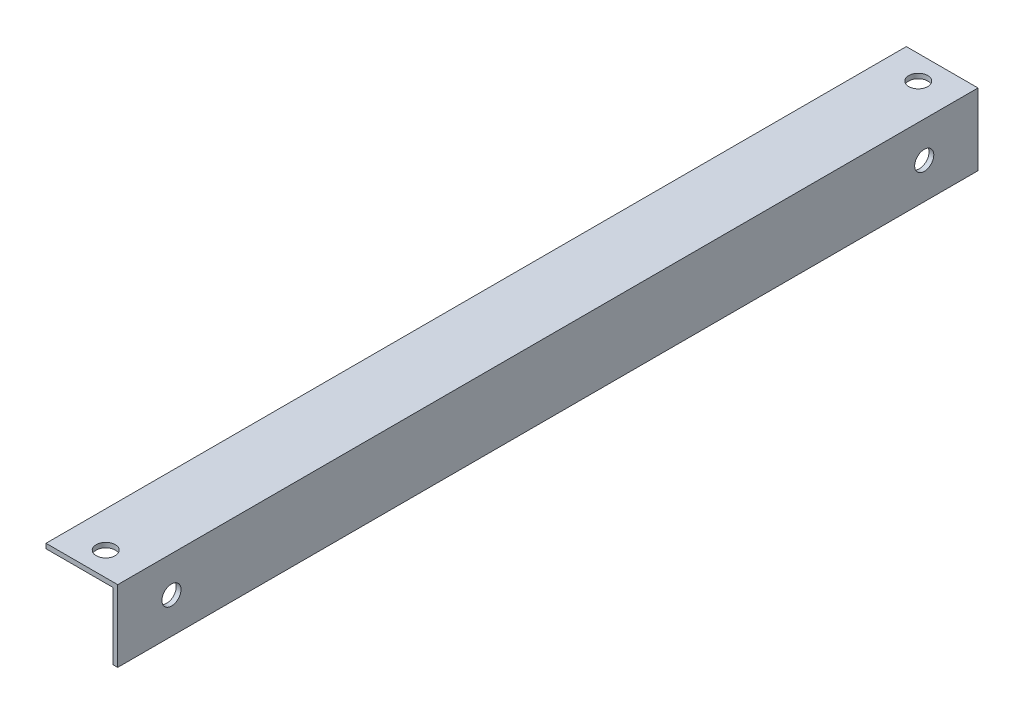
from build123d import *

# Parameters (mm, degrees)
BOSS_EXTRUDE1_DEPTH = 180
CUT_EXTRUDE1_REACH  = 186.932
SKETCH2_R           = 4
CUT_EXTRUDE2_REACH  = 186.932
SKETCH3_R           = 4


with BuildPart() as part:
    # Sketch1 → Boss-Extrude1 (new, symmetric)
    with BuildSketch(Plane.XY):
        Polygon((0, 0), (-30, 0), (-30, -2), (-2, -2), (-2, -30), (0, -30), align=None)
    extrude(amount=BOSS_EXTRUDE1_DEPTH, both=True)

    # Sketch2 → Cut-Extrude1 (cut, up to next)
    with BuildSketch(Plane(origin=(0, 0, 0), x_dir=(1, 0, 0), z_dir=(0, 1, 0)), mode=Mode.PRIVATE) as cut_extrude1_sk1:
        with Locations((-15, 170)):
            Circle(SKETCH2_R)
    cut_extrude1_tool1 = extrude(cut_extrude1_sk1.sketch, amount=-CUT_EXTRUDE1_REACH, mode=Mode.PRIVATE) & part.part
    cut_extrude1 = cut_extrude1_tool1.solids().sort_by_distance((-15, 0, -170))[0]
    add(cut_extrude1, mode=Mode.SUBTRACT)

    # Sketch3 → Cut-Extrude2 (cut, up to next)
    with BuildSketch(Plane(origin=(0, 0, 0), x_dir=(0, 0, -1), z_dir=(1, 0, 0)), mode=Mode.PRIVATE) as cut_extrude2_sk1:
        with Locations((157.5, -15)):
            Circle(SKETCH3_R)
    cut_extrude2_tool1 = extrude(cut_extrude2_sk1.sketch, amount=-CUT_EXTRUDE2_REACH, mode=Mode.PRIVATE) & part.part
    cut_extrude2 = cut_extrude2_tool1.solids().sort_by_distance((0, -15, -157.5))[0]
    add(cut_extrude2, mode=Mode.SUBTRACT)

    # Mirror1: Cut-Extrude1, Cut-Extrude2 across plane
    add(cut_extrude1.mirror(Plane.XY), mode=Mode.SUBTRACT)
    add(cut_extrude2.mirror(Plane.XY), mode=Mode.SUBTRACT)


solid = part.part
